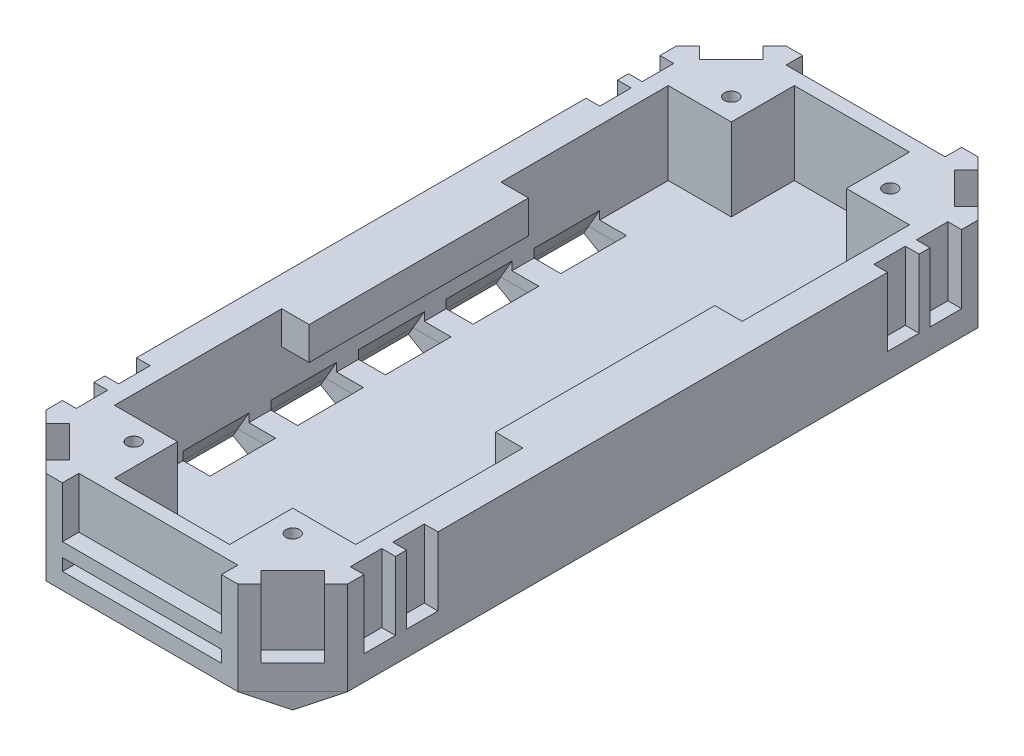
from build123d import *

# Parameters (mm, degrees)
SKETCH1_W               = 55
SKETCH1_H               = 135
BOSS_EXTRUDE1_DEPTH     = 17
CUT_EXTRUDE1_DEPTH      = 15
SKETCH9_W               = 40
SKETCH9_H               = 6
BOSS_EXTRUDE3_DEPTH     = 5
SKETCH11_W              = 8.980762114
SKETCH11_H              = 10
BOSS_EXTRUDE4_DEPTH     = 135
CHAMFER2_SIZE           = 10
CUT_EXTRUDE8_DEPTH      = 80
SKETCH6_R               = 1.25
CUT_EXTRUDE9_DEPTH      = 75.843169361
CUT_EXTRUDE10_DEPTH     = 75.843169361
SKETCH14_W              = 65
SKETCH14_H              = 2.551410829
CUT_EXTRUDE11_DEPTH     = 80.309401285
SKETCH15_W              = 29
SKETCH15_H              = 9.300490625
SKETCH15_H_2            = 2.199509375
CUT_EXTRUDE12_DEPTH     = 3
SKETCH16_W              = 8.142135623
SKETCH16_H              = 12.5
CUT_EXTRUDE13_DEPTH     = 3
MIRROR5_COPY_1_SKETCH_W = 8.142135623
MIRROR5_COPY_1_SKETCH_H = 12.5
MIRROR5_COPY_1_DEPTH    = 3
SKETCH19_W              = 5.75
SKETCH19_H              = 12.5
CUT_EXTRUDE14_DEPTH     = 2.5
MIRROR7_COPY_1_SKETCH_W = 5.75
MIRROR7_COPY_1_SKETCH_H = 12.5
MIRROR7_COPY_1_DEPTH    = 2.5
SKETCH20_W              = 5
SKETCH20_H              = 12
CUT_EXTRUDE15_DEPTH     = 8


with BuildPart() as part:
    # Sketch1 → Boss-Extrude1 (new body)
    with BuildSketch(Plane(origin=(0, 0, 0), x_dir=(1, 0, 0), z_dir=(0, 1, 0))):
        Rectangle(SKETCH1_W, SKETCH1_H)
    extrude(amount=BOSS_EXTRUDE1_DEPTH)

    # Sketch2 → Cut-Extrude1 (cut)
    with BuildSketch(Plane(origin=(0, 17, 0), x_dir=(1, 0, 0), z_dir=(0, 1, 0))):
        Polygon((-10.5, 62), (10.5, 62), (10.5, 50.5), (22, 50.5), (22, -50.5), (10.5, -50.5), (10.5, -62), (-10.5, -62), (-10.5, -50.5), (-22, -50.5), (-22, 50.5), (-10.5, 50.5), align=None)
    extrude(amount=-CUT_EXTRUDE1_DEPTH, mode=Mode.SUBTRACT)

    # Sketch9 → Boss-Extrude3 (add)
    with BuildSketch(Plane.ZY.offset(-22)):
        with Locations((0, 14)):
            Rectangle(SKETCH9_W, SKETCH9_H)
    boss_extrude3 = extrude(amount=BOSS_EXTRUDE3_DEPTH)

    # Mirror1: Boss-Extrude3 across plane
    add(boss_extrude3.mirror(Plane(origin=(0, 0, 0), x_dir=(0, 0, 1), z_dir=(1, 0, 0))))

    # Chamfer2
    chamfer2_edges = [part.edges().sort_by_distance(p)[0] for p in [
        (27.5, 8.5, 67.5),
        (-27.5, 8.5, 67.5),
        (-27.5, 8.5, -67.5),
        (27.5, 8.5, -67.5),
    ]]
    chamfer(chamfer2_edges, length=CHAMFER2_SIZE)

    # Sketch6 → Cut-Extrude9 (cut, through all)
    with BuildSketch(Plane.XZ):
        with Locations(Location((14.5, -54.5, 0), (0, 0, 270))):
            Circle(SKETCH6_R)
        with Locations(Location((-14.5, -54.5, 0), (0, 0, 90))):
            Circle(SKETCH6_R)
        with Locations(Location((14.5, 54.5, 0), (0, 0, 90))):
            Circle(SKETCH6_R)
        with Locations(Location((-14.5, 54.5, 0), (0, 0, 270))):
            Circle(SKETCH6_R)
    extrude(amount=-CUT_EXTRUDE9_DEPTH, mode=Mode.SUBTRACT)

    # Sketch15 → Cut-Extrude12 (cut)
    with BuildSketch(Plane.XY.offset(67.5)):
        with Locations((0, 12.349754688)):
            Rectangle(SKETCH15_W, SKETCH15_H)
        with Locations((0, 4.099754688)):
            Rectangle(SKETCH15_W, SKETCH15_H_2)
    cut_extrude12 = extrude(amount=-CUT_EXTRUDE12_DEPTH, mode=Mode.SUBTRACT)

    # Sketch16 → Cut-Extrude13 (cut)
    with BuildSketch(Plane(origin=(-42.5, 0, 42.5), x_dir=(0.7071067811865458, 0, 0.7071067811865492), z_dir=(-0.7071067811865492, 0, 0.7071067811865458))):
        with Locations((28.284271248, 10.75)):
            Rectangle(SKETCH16_W, SKETCH16_H)
    cut_extrude13 = extrude(amount=-CUT_EXTRUDE13_DEPTH, mode=Mode.SUBTRACT)

    # Mirror4: Cut-Extrude13 across plane
    add(cut_extrude13.mirror(Plane(origin=(0, 0, 0), x_dir=(0, 0, 1), z_dir=(1, 0, 0))), mode=Mode.SUBTRACT)

    # Mirror5: Cut-Extrude12, Cut-Extrude13 across plane
    add(cut_extrude12.mirror(Plane.XY), mode=Mode.SUBTRACT)
    add(cut_extrude13.mirror(Plane.XY), mode=Mode.SUBTRACT)

    # Mirror5 copy 1 sketch → Mirror5 copy 1 (cut)
    with BuildSketch(Plane(origin=(42.5, 0, -42.5), x_dir=(-0.7071067811865458, 0, -0.7071067811865492), z_dir=(0.7071067811865492, 0, -0.7071067811865458))):
        with Locations((28.284271248, 10.75)):
            Rectangle(MIRROR5_COPY_1_SKETCH_W, MIRROR5_COPY_1_SKETCH_H)
    extrude(amount=-MIRROR5_COPY_1_DEPTH, mode=Mode.SUBTRACT)

    # Sketch19 → Cut-Extrude14 (cut)
    with BuildSketch(Plane.ZY.offset(27.5)):
        with Locations((51.625, 10.75)):
            Rectangle(SKETCH19_W, SKETCH19_H)
        with Locations((43.875, 10.75)):
            Rectangle(SKETCH19_W, SKETCH19_H)
    cut_extrude14 = extrude(amount=-CUT_EXTRUDE14_DEPTH, mode=Mode.SUBTRACT)

    # Mirror6: Cut-Extrude14 across plane
    add(cut_extrude14.mirror(Plane.XY), mode=Mode.SUBTRACT)

    # Mirror7: Cut-Extrude14 across plane
    add(cut_extrude14.mirror(Plane(origin=(0, 0, 0), x_dir=(0, 0, 1), z_dir=(1, 0, 0))), mode=Mode.SUBTRACT)

    # Mirror7 copy 1 sketch → Mirror7 copy 1 (cut)
    with BuildSketch(Plane(origin=(27.5, 0, 0), x_dir=(0, 0, -1), z_dir=(1, 0, 0))):
        with Locations((51.625, 10.75)):
            Rectangle(MIRROR7_COPY_1_SKETCH_W, MIRROR7_COPY_1_SKETCH_H)
        with Locations((43.875, 10.75)):
            Rectangle(MIRROR7_COPY_1_SKETCH_W, MIRROR7_COPY_1_SKETCH_H)
    extrude(amount=-MIRROR7_COPY_1_DEPTH, mode=Mode.SUBTRACT)


with BuildPart() as body_2:
    # Sketch11 → Boss-Extrude4 (new body)
    with BuildSketch(Plane.XY.offset(67.5)):
        Polygon((14.509618943, -7.5), (27.5, 0), (4.490381057, 0), (4.490381057, -10), (10.509618943, -10), (10.509618943, -7.5), align=None)
        Polygon((-4.490381057, -10), (-4.490381057, 0), (-27.5, 0), (-14.509618943, -7.5), (-10.509618943, -7.5), (-10.509618943, -10), align=None)
        with Locations((0, -5)):
            Rectangle(SKETCH11_W, SKETCH11_H)
    extrude(amount=-BOSS_EXTRUDE4_DEPTH)

    # Sketch12 → Cut-Extrude8 (cut)
    with BuildSketch(Plane(origin=(30, 0, 0), x_dir=(0, 0, -1), z_dir=(1, 0, 0))):
        Polygon((-67.5, 0), (-50.179491924, -10), (-67.5, -10), align=None)
    cut_extrude8 = extrude(amount=-CUT_EXTRUDE8_DEPTH, mode=Mode.SUBTRACT)

    # Mirror2: Cut-Extrude8 across plane
    add(cut_extrude8.mirror(Plane.XY), mode=Mode.SUBTRACT)

    # Sketch13 → Cut-Extrude10 (cut, through all)
    with BuildSketch(Plane(origin=(0, 0, 0), x_dir=(1, 0, 0), z_dir=(0, 1, 0))):
        Polygon((-27.5, 57.5), (-27.5, 67.5), (-17.5, 67.5), align=None)
        Polygon((27.5, 67.5), (17.5, 67.5), (27.5, 57.5), align=None)
        Polygon((27.5, -57.5), (27.5, -67.5), (17.5, -67.5), align=None)
        Polygon((-27.5, -67.5), (-17.5, -67.5), (-27.5, -57.5), align=None)
    extrude(amount=-CUT_EXTRUDE10_DEPTH, mode=Mode.SUBTRACT)

    # Sketch14 → Cut-Extrude11 (cut, through all)
    with BuildSketch(Plane.ZY.offset(10.509618943)):
        with Locations((0, -8.775705415)):
            Rectangle(SKETCH14_W, SKETCH14_H)
    extrude(amount=-CUT_EXTRUDE11_DEPTH, mode=Mode.SUBTRACT)


with BuildPart() as cut_extrude15_tool:
    # Sketch20 → Cut-Extrude15 (new body)
    with BuildSketch(Plane(origin=(-6.875, -11.907849302, 0), x_dir=(0.866025403784438, -0.5000000000000012, 0), z_dir=(-0.5000000000000011, -0.8660254037844379, 0))):
        with Locations((-18.315698604, 32)):
            Rectangle(SKETCH20_W, SKETCH20_H)
        with Locations((-18.315698604, 16)):
            Rectangle(SKETCH20_W, SKETCH20_H)
        with Locations((-18.315698604, 0)):
            Rectangle(SKETCH20_W, SKETCH20_H)
        with Locations((-18.315698604, -16)):
            Rectangle(SKETCH20_W, SKETCH20_H)
        with Locations((-18.315698604, -32)):
            Rectangle(SKETCH20_W, SKETCH20_H)
    cut_extrude15 = extrude(amount=-CUT_EXTRUDE15_DEPTH)


with BuildPart() as part_1:
    add(part.part)

    # Cut-Extrude15: cut by cut_extrude15_tool
    add(cut_extrude15_tool.part, mode=Mode.SUBTRACT)


with BuildPart() as body_2_1:
    add(body_2.part)

    # Cut-Extrude15: cut by cut_extrude15_tool
    add(cut_extrude15_tool.part, mode=Mode.SUBTRACT)


with BuildPart() as mirror8_tool:
    # Mirror8: Cut-Extrude15 across plane
    add(cut_extrude15.mirror(Plane(origin=(0, 0, 0), x_dir=(0, 0, 1), z_dir=(1, 0, 0))))


with BuildPart() as part_2:
    add(part_1.part)

    # Mirror8: cut by mirror8_tool
    add(mirror8_tool.part, mode=Mode.SUBTRACT)


with BuildPart() as body_2_2:
    add(body_2_1.part)

    # Mirror8: cut by mirror8_tool
    add(mirror8_tool.part, mode=Mode.SUBTRACT)


solid = Compound([part_2.part, body_2_2.part])
